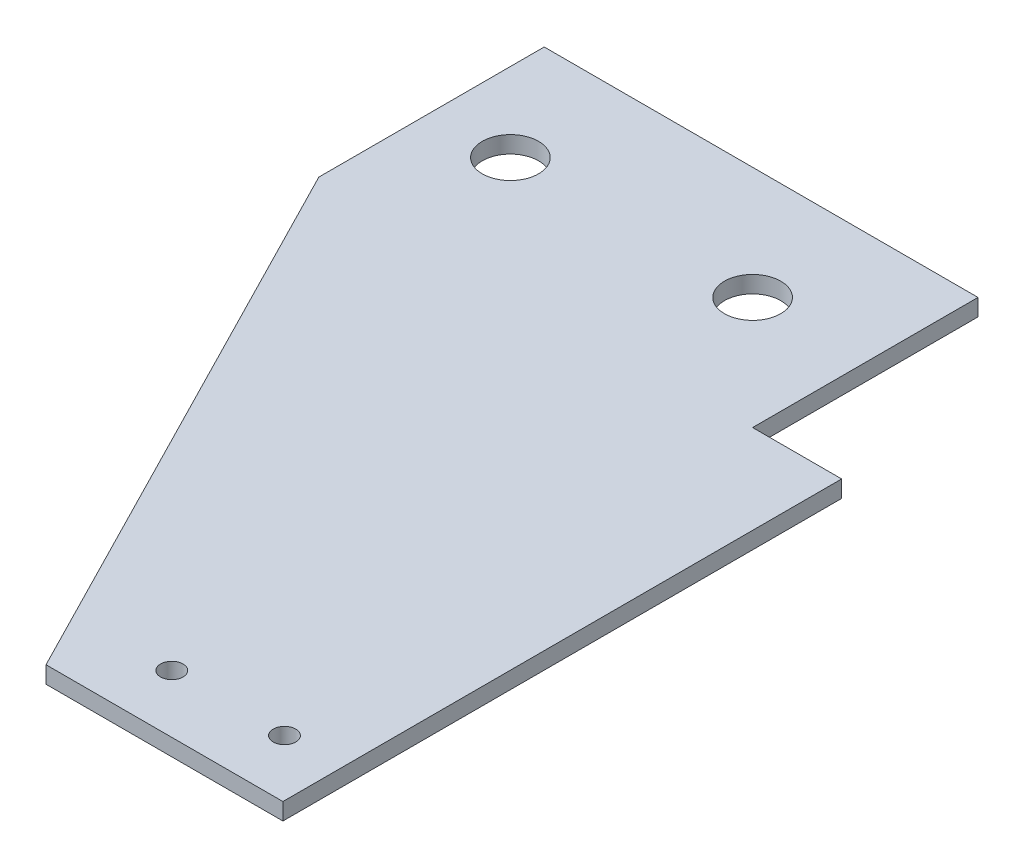
from build123d import *

# Parameters (mm, degrees)
SKETCH1_R           = 2.5
SKETCH1_R_2         = 1
BOSS_EXTRUDE1_DEPTH = 1.5


with BuildPart() as part:
    # Sketch1 → Boss-Extrude1 (new body)
    with BuildSketch(Plane(origin=(0, 0, 0), x_dir=(1, 0, 0), z_dir=(0, 1, 0))):
        Polygon((-7.9, 71.58), (-46.39309335, 71.58), (-46.39309335, 51.58), (-21.023384775, 2), (0, 2), (0, 51.58), (-7.9, 51.58), align=None)
        with Locations(Location((-17.9, 61.58, 0), (0, 0, 270))):
            Circle(SKETCH1_R, mode=Mode.SUBTRACT)
        with Locations(Location((-39.39309335, 61.58, 0), (0, 0, 270))):
            Circle(SKETCH1_R, mode=Mode.SUBTRACT)
        with Locations(Location((-5, 7.14, 0), (0, 0, 270))):
            Circle(SKETCH1_R_2, mode=Mode.SUBTRACT)
        with Locations(Location((-15, 7.14, 0), (0, 0, 270))):
            Circle(SKETCH1_R_2, mode=Mode.SUBTRACT)
    extrude(amount=BOSS_EXTRUDE1_DEPTH)


solid = part.part
